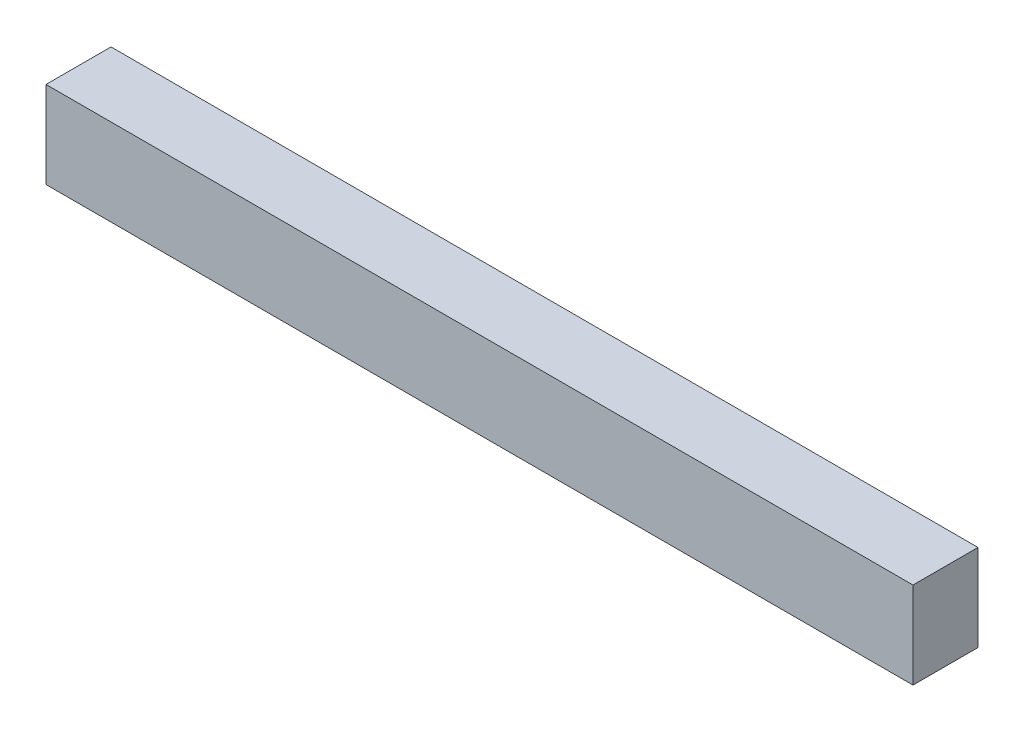
from build123d import *

# Parameters (mm, degrees)
SKETCH1_W           = 40
SKETCH1_H           = 3
BOSS_EXTRUDE1_DEPTH = 4


with BuildPart() as part:
    # Sketch1 → Boss-Extrude1 (new body)
    with BuildSketch(Plane(origin=(0, 0, 0), x_dir=(1, 0, 0), z_dir=(0, 1, 0))):
        with Locations((20, 1.5)):
            Rectangle(SKETCH1_W, SKETCH1_H)
    extrude(amount=BOSS_EXTRUDE1_DEPTH)


solid = part.part
